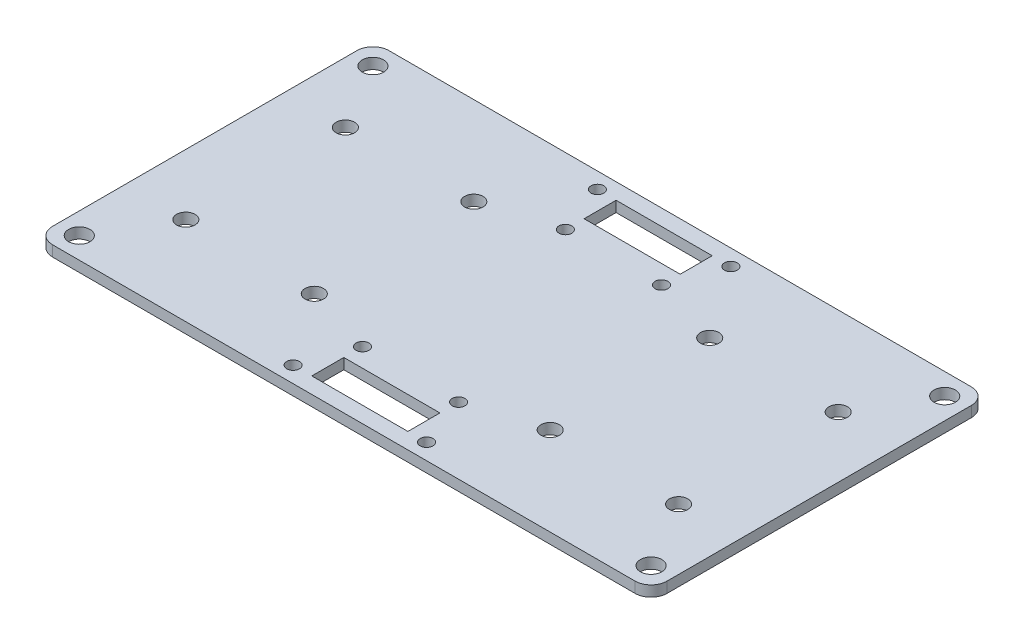
from build123d import *

# Parameters (mm, degrees)
ESBO_O1_W                = 115.09677689
ESBO_O1_H                = 63
RESSALTO_EXTRUS_O1_DEPTH = 2
ESBO_O2_R                = 1.73
CORTE_EXTRUS_O1_DEPTH    = 66.635866816
ESBO_O3_W                = 18
ESBO_O3_H                = 6
CORTE_EXTRUS_O2_DEPTH    = 66.635866816
ESBO_O5_R                = 2
CORTE_EXTRUS_O3_DEPTH    = 66.635866816
FILETE1_R                = 3
ESBO_O8_R                = 1.2
CORTE_EXTRUS_O4_DEPTH    = 66.635866816


with BuildPart() as part:
    # Esboço1 → Ressalto-extrusão1 (new body)
    with BuildSketch(Plane(origin=(0, 0, 0), x_dir=(1, 0, 0), z_dir=(0, 1, 0))):
        Rectangle(ESBO_O1_W, ESBO_O1_H)
    extrude(amount=RESSALTO_EXTRUS_O1_DEPTH)

    # Esboço2 → Corte-extrusão1 (cut, through all)
    with BuildSketch(Plane(origin=(0, 2, 0), x_dir=(1, 0, 0), z_dir=(0, 1, 0))):
        with Locations(Location((-46.153556516, -14.945, 0), (0, 0, 270))):
            Circle(ESBO_O2_R)
        with Locations(Location((-22.093556516, -14.94, 0), (0, 0, 270))):
            Circle(ESBO_O2_R)
        with Locations(Location((22.093556516, -14.94, 0), (0, 0, 90))):
            Circle(ESBO_O2_R)
        with Locations(Location((46.153556516, -14.945, 0), (0, 0, 90))):
            Circle(ESBO_O2_R)
        with Locations(Location((46.153556516, 14.945, 0), (0, 0, 270))):
            Circle(ESBO_O2_R)
        with Locations(Location((22.093556516, 14.94, 0), (0, 0, 270))):
            Circle(ESBO_O2_R)
        with Locations(Location((-22.093556516, 14.94, 0), (0, 0, 90))):
            Circle(ESBO_O2_R)
        with Locations(Location((-46.153556516, 14.945, 0), (0, 0, 90))):
            Circle(ESBO_O2_R)
    extrude(amount=-CORTE_EXTRUS_O1_DEPTH, mode=Mode.SUBTRACT)

    # Esboço3 → Corte-extrusão2 (cut, through all)
    with BuildSketch(Plane.XZ):
        with Locations((0, 25.5)):
            Rectangle(ESBO_O3_W, ESBO_O3_H)
        with Locations((0, -25.5)):
            Rectangle(ESBO_O3_W, ESBO_O3_H)
    extrude(amount=-CORTE_EXTRUS_O2_DEPTH, mode=Mode.SUBTRACT)

    # Esboço5 → Corte-extrusão3 (cut, through all)
    with BuildSketch(Plane(origin=(0, 2, 0), x_dir=(1, 0, 0), z_dir=(0, 1, 0))):
        with Locations(Location((53.548388445, 27.5, 0), (0, 0, 270))):
            Circle(ESBO_O5_R)
        with Locations(Location((53.548388445, -27.5, 0), (0, 0, 90))):
            Circle(ESBO_O5_R)
        with Locations(Location((-53.548388445, -27.5, 0), (0, 0, 270))):
            Circle(ESBO_O5_R)
        with Locations(Location((-53.548388445, 27.5, 0), (0, 0, 90))):
            Circle(ESBO_O5_R)
    extrude(amount=-CORTE_EXTRUS_O3_DEPTH, mode=Mode.SUBTRACT)

    # Filete1
    filete1_edges = [part.edges().sort_by_distance(p)[0] for p in [
        (-57.548388445, 1, -31.5),
        (57.548388445, 1, -31.5),
        (57.548388445, 1, 31.5),
        (-57.548388445, 1, 31.5),
    ]]
    fillet(filete1_edges, radius=FILETE1_R)

    # Esboço8 → Corte-extrusão4 (cut, through all)
    with BuildSketch(Plane(origin=(0, 2, 0), x_dir=(1, 0, 0), z_dir=(0, 1, 0))):
        with Locations(Location((-12.498388445, 28.5, 0), (0, 0, 270))):
            Circle(ESBO_O8_R)
        with Locations(Location((12.498388445, 28.5, 0), (0, 0, 90))):
            Circle(ESBO_O8_R)
        with Locations(Location((12.498388445, -28.5, 0), (0, 0, 270))):
            Circle(ESBO_O8_R)
        with Locations(Location((-12.498388445, -28.5, 0), (0, 0, 90))):
            Circle(ESBO_O8_R)
        with Locations(Location((-8.998388445, -19, 0), (0, 0, 270))):
            Circle(ESBO_O8_R)
        with Locations(Location((8.998388445, -19, 0), (0, 0, 90))):
            Circle(ESBO_O8_R)
        with Locations(Location((8.998388445, 19, 0), (0, 0, 270))):
            Circle(ESBO_O8_R)
        with Locations(Location((-8.998388445, 19, 0), (0, 0, 90))):
            Circle(ESBO_O8_R)
    extrude(amount=-CORTE_EXTRUS_O4_DEPTH, mode=Mode.SUBTRACT)


solid = part.part
